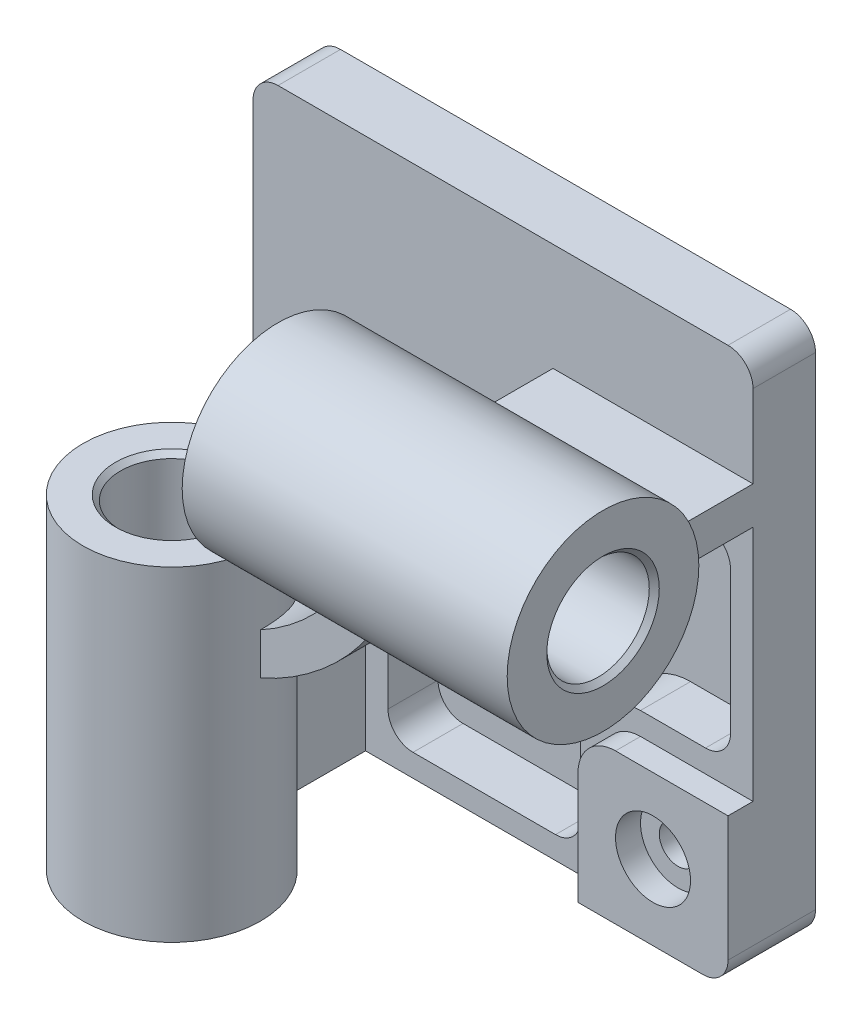
from build123d import *

# Parameters (mm, degrees)
BOSS_EXTRUDE1_DEPTH                     = 25
BOSS_EXTRUDE1_2_DEPTH                   = 25
BOSS_EXTRUDE2_DEPTH                     = 35
BOSS_EXTRUDE3_DEPTH                     = 95
BOSS_EXTRUDE4_START                     = 10
SKETCH3_R                               = 38.335
BOSS_EXTRUDE4_DEPTH                     = 130
BOSS_EXTRUDE5_START                     = 10
SKETCH4_R                               = 35.5
BOSS_EXTRUDE5_DEPTH                     = 130
SKETCH5_R                               = 20.5
CUT_EXTRUDE1_DEPTH                      = 335.07667128
SKETCH6_R                               = 20.5
CUT_EXTRUDE2_DEPTH                      = 328.486216888
CUT_EXTRUDE7_DEPTH                      = 20
FILLET1_R                               = 10
CBORE_FOR_M8_HEX_HEAD_BOLT1_D           = 15
CBORE_FOR_M8_HEX_HEAD_BOLT1_CBORE_D     = 30
CBORE_FOR_M8_HEX_HEAD_BOLT1_CBORE_DEPTH = 10
CHAMFER1_SIZE                           = 2


with BuildPart() as part:
    # Sketch2 → Boss-Extrude1 (new body)
    with BuildSketch(Plane.XY):
        with BuildLine():
            Line((10, 0), (30, 0))
            Line((30, 0), (30, 80))
            ThreePointArc((30, 80), (93.639610307, 106.360389693), (120, 170))
            Line((120, 170), (200, 170))
            Line((200, 170), (200, 203))
            ThreePointArc((200, 203), (197.071067812, 210.071067812), (190, 213))
            Line((190, 213), (10, 213))
            ThreePointArc((10, 213), (2.928932188, 210.071067812), (0, 203))
            Line((0, 203), (0, 10))
            ThreePointArc((0, 10), (2.928932188, 2.928932188), (10, 0))
        make_face()
    extrude(amount=BOSS_EXTRUDE1_DEPTH)



with BuildPart() as body_2:
    # Sketch2 → Boss-Extrude1 2 (new body)
    with BuildSketch(Plane.XY):
        with BuildLine():
            Line((45, 66.076951546), (45, 0))
            Line((45, 0), (140, 0))
            Line((140, 0), (140, 45))
            ThreePointArc((140, 45), (144.393398282, 55.606601718), (155, 60))
            Line((155, 60), (200, 60))
            Line((200, 60), (200, 155))
            Line((200, 155), (133.923048454, 155))
            ThreePointArc((133.923048454, 155), (104.246212025, 95.753787975), (45, 66.076951546))
        make_face()
    extrude(amount=BOSS_EXTRUDE1_2_DEPTH)

    # Sketch2<3> → Boss-Extrude2 (add)
    with BuildSketch(Plane.XY):
        with BuildLine():
            Line((140, 45), (140, 0))
            Line((140, 0), (190, 0))
            ThreePointArc((190, 0), (197.071067812, 2.928932188), (200, 10))
            Line((200, 10), (200, 60))
            Line((200, 60), (155, 60))
            ThreePointArc((155, 60), (144.393398282, 55.606601718), (140, 45))
        make_face()
    extrude(amount=BOSS_EXTRUDE2_DEPTH)


with BuildPart() as part_1:
    add(part.part)

    add(body_2.part)  # Boss-Extrude3 merges body 2
    # Sketch2<4> → Boss-Extrude3 (add)
    with BuildSketch(Plane.XY):
        with BuildLine():
            Line((30, 80), (30, 0))
            Line((30, 0), (45, 0))
            Line((45, 0), (45, 66.076951546))
            ThreePointArc((45, 66.076951546), (104.246212025, 95.753787975), (133.923048454, 155))
            Line((133.923048454, 155), (200, 155))
            Line((200, 155), (200, 170))
            Line((200, 170), (120, 170))
            ThreePointArc((120, 170), (93.639610307, 106.360389693), (30, 80))
        make_face()
    extrude(amount=BOSS_EXTRUDE3_DEPTH)

    # Sketch3 → Boss-Extrude4 (add)
    with BuildSketch(Plane(origin=(200, 0, 0), x_dir=(0, 0, -1), z_dir=(1, 0, 0)).offset(BOSS_EXTRUDE4_START)):
        with Locations((-95, 162.5)):
            Circle(SKETCH3_R)
    extrude(amount=-BOSS_EXTRUDE4_DEPTH)

    # Sketch4 → Boss-Extrude5 (add)
    with BuildSketch(Plane.XZ.offset(BOSS_EXTRUDE5_START)):
        with Locations(Location((37.5, 95, 0), (0, 0, 270))):
            Circle(SKETCH4_R)
    extrude(amount=-BOSS_EXTRUDE5_DEPTH)

    # Sketch5 → Cut-Extrude1 (cut, through all)
    with BuildSketch(Plane.XZ.offset(10)):
        with Locations(Location((37.5, 95, 0), (0, 0, 270))):
            Circle(SKETCH5_R)
    extrude(amount=-CUT_EXTRUDE1_DEPTH, mode=Mode.SUBTRACT)

    # Sketch6 → Cut-Extrude2 (cut, through all)
    with BuildSketch(Plane(origin=(210, 0, 0), x_dir=(0, 0, -1), z_dir=(1, 0, 0))):
        with Locations((-95, 162.5)):
            Circle(SKETCH6_R)
    extrude(amount=-CUT_EXTRUDE2_DEPTH, mode=Mode.SUBTRACT)

    # Sketch8 → Cut-Extrude7 (cut)
    with BuildSketch(Plane.XY.offset(25)):
        with BuildLine():
            Line((191, 146), (141.445053726, 146))
            ThreePointArc((141.445053726, 146), (110.610173055, 89.389826945), (54, 58.554946274))
            Line((54, 58.554946274), (54, 9))
            Line((54, 9), (131, 9))
            Line((131, 9), (131, 45))
            ThreePointArc((131, 45), (138.029437252, 61.970562748), (155, 69))
            Line((155, 69), (191, 69))
            Line((191, 69), (191, 146))
        make_face()
    extrude(amount=-CUT_EXTRUDE7_DEPTH, mode=Mode.SUBTRACT)

    # Fillet1
    fillet1_edges = [part_1.edges().sort_by_distance(p)[0] for p in [
        (131, 9, 15),
        (54, 9, 15),
        (54, 58.554946274, 15),
        (141.445053726, 146, 15),
        (191, 146, 15),
        (191, 69, 15),
    ]]
    fillet(fillet1_edges, radius=FILLET1_R)

    # CBORE for M8 Hex Head Bolt1 (through all)
    with Locations(Plane(origin=(170, 30, 35), x_dir=(1, 0, 0), z_dir=(0, 0, 1))):
        with Locations((0, 0)):
            CounterBoreHole(CBORE_FOR_M8_HEX_HEAD_BOLT1_D / 2, CBORE_FOR_M8_HEX_HEAD_BOLT1_CBORE_D / 2, CBORE_FOR_M8_HEX_HEAD_BOLT1_CBORE_DEPTH)

    # Chamfer1
    chamfer1_edges = [part_1.edges().sort_by_distance(p)[0] for p in [
        (37.5, 120, 115.5),
        (37.5, -10, 115.5),
        (80, 162.5, 115.5),
        (210, 162.5, 115.5),
    ]]
    chamfer(chamfer1_edges, length=CHAMFER1_SIZE)


solid = part_1.part
